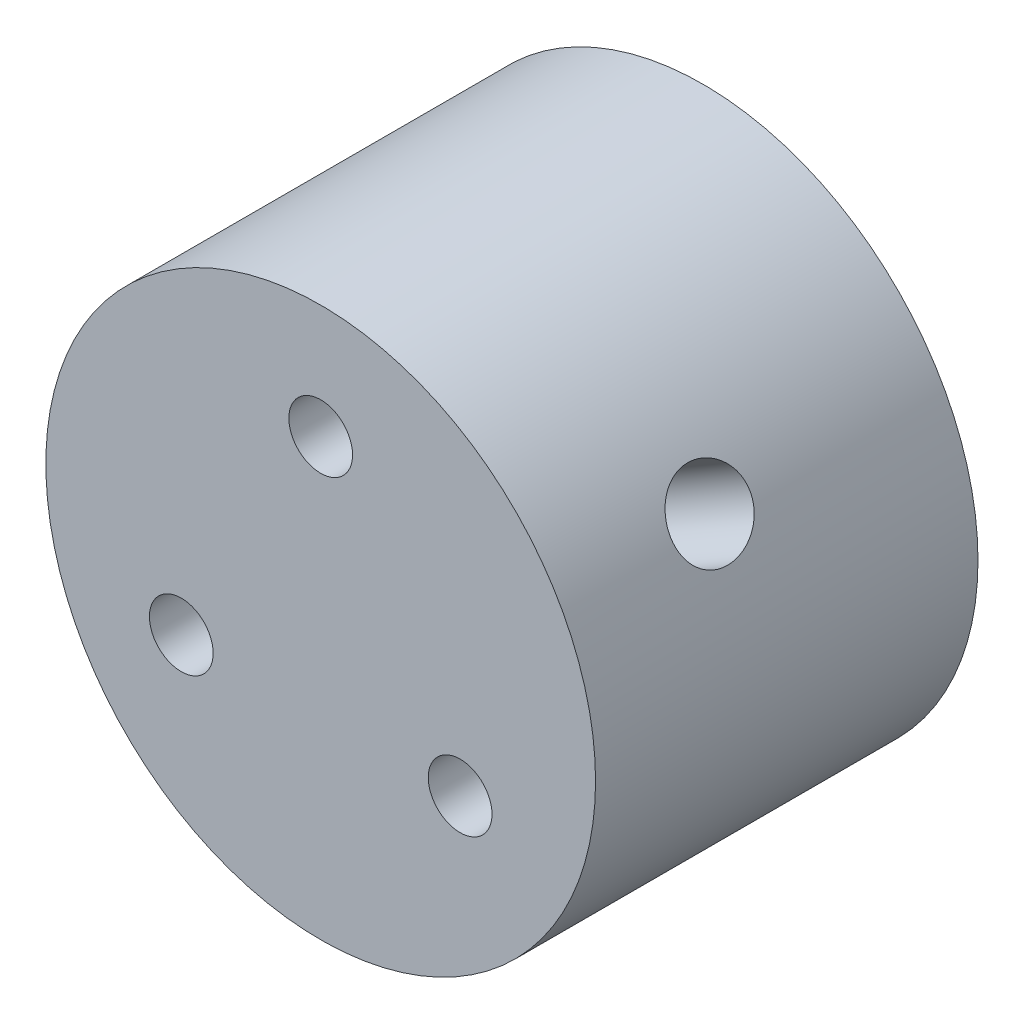
from build123d import *

# Parameters (mm, degrees)
SKICA1_R                 = 34.5
P_IDAT_VYSUNUT_M1_DEPTH  = 48
SKICA2_R                 = 4
ODEBRAT_VYSUNUT_M1_DEPTH = 40
SKICA3_R                 = 5
ODEBRAT_VYSUNUT_M2_DEPTH = 69.443407279
KRUHOV_POLE1_COUNT       = 3


with BuildPart() as part:
    # Skica1 → Přidat vysunutím1 (new body)
    with BuildSketch(Plane.XY):
        Circle(SKICA1_R)
    extrude(amount=P_IDAT_VYSUNUT_M1_DEPTH)

    # Skica2 → Odebrat vysunutím1 (cut)
    with BuildSketch(Plane.XY.offset(48)):
        with Locations((0, 20.207259422)):
            Circle(SKICA2_R)
        with Locations((17.5, -10.103629711)):
            Circle(SKICA2_R)
        with Locations((-17.5, -10.103629711)):
            Circle(SKICA2_R)
    extrude(amount=-ODEBRAT_VYSUNUT_M1_DEPTH, mode=Mode.SUBTRACT)

    # Skica3 → Odebrat vysunutím2 (cut, through all)
    with BuildSketch(Plane(origin=(0, 0, 0), x_dir=(1, 0, 0), z_dir=(0, 1, 0))):
        with Locations(Location((0, -29, 0), (0, 0, 270))):
            Circle(SKICA3_R)
    odebrat_vysunut_m2 = extrude(amount=-ODEBRAT_VYSUNUT_M2_DEPTH, mode=Mode.SUBTRACT)

    # Kruhové pole1: Odebrat vysunutím2 ×3 about axis
    kruhov_pole1_axis = Axis((0, 0, 48), (0, 0, -1))
    for i in range(1, KRUHOV_POLE1_COUNT):
        add(odebrat_vysunut_m2.rotate(kruhov_pole1_axis, i * 360 / KRUHOV_POLE1_COUNT), mode=Mode.SUBTRACT)


solid = part.part
